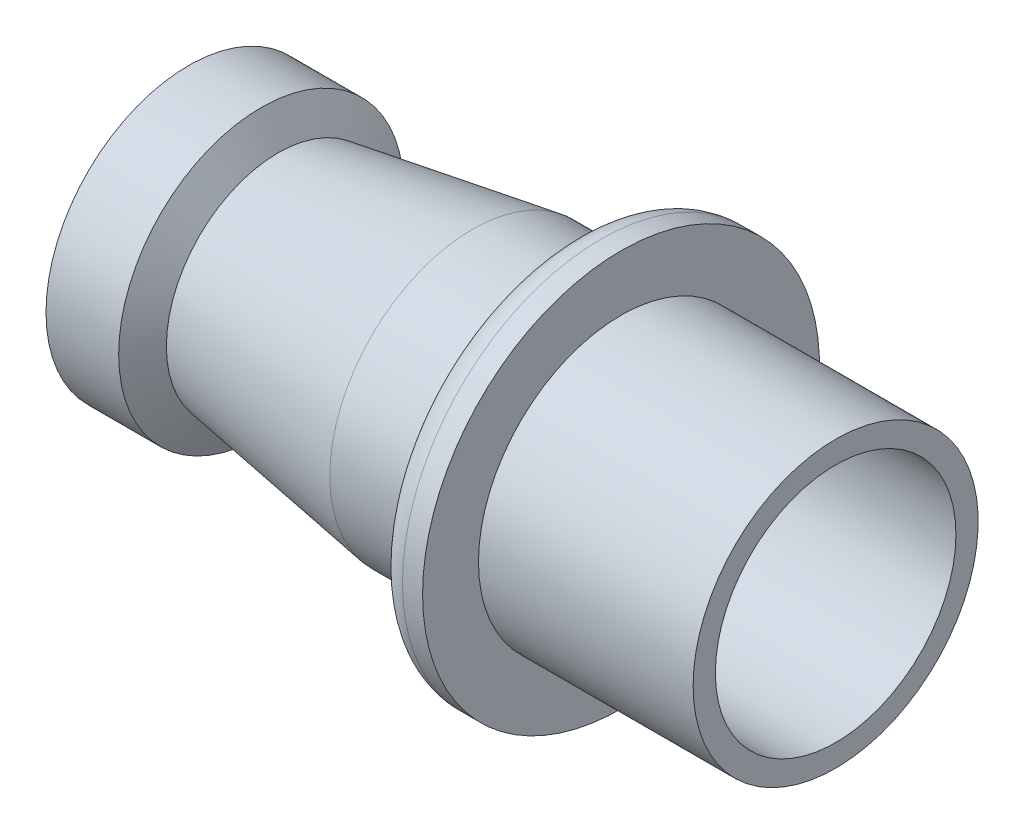
from build123d import *

# Parameters (mm, degrees)
FILLET1_R = 0.127


with BuildPart() as part:
    # Sketch1 → Revolve1 (revolve)
    with BuildSketch(Plane.XY, mode=Mode.PRIVATE) as revolve1_sk:
        Polygon((88.476526811, 146.943032749), (88.898166811, 146.943032749), (88.961666811, 147.197032749), (89.152166811, 147.197032749), (89.152166811, 146.943032749), (90.127526811, 146.943032749), (90.127526811, 146.841971125), (88.628926811, 146.841971125), (88.628926811, 146.714971125), (87.186879843, 146.714971125), (87.186879843, 146.943032749), (87.517079843, 146.943032749), (87.594159764, 146.803332749), align=None)
    revolve(revolve1_sk.sketch.rotate(Axis((82.894279843, 146.295332749, 0), (1, 0, 0)), 90), axis=Axis((82.894279843, 146.295332749, 0), (1, 0, 0)))

    # Fillet1
    fillet1_edges = [part.edges().sort_by_distance(p)[0] for p in [
        (88.961666811, 146.295332749, -0.9017),
    ]]
    fillet(fillet1_edges, radius=FILLET1_R)


solid = part.part
